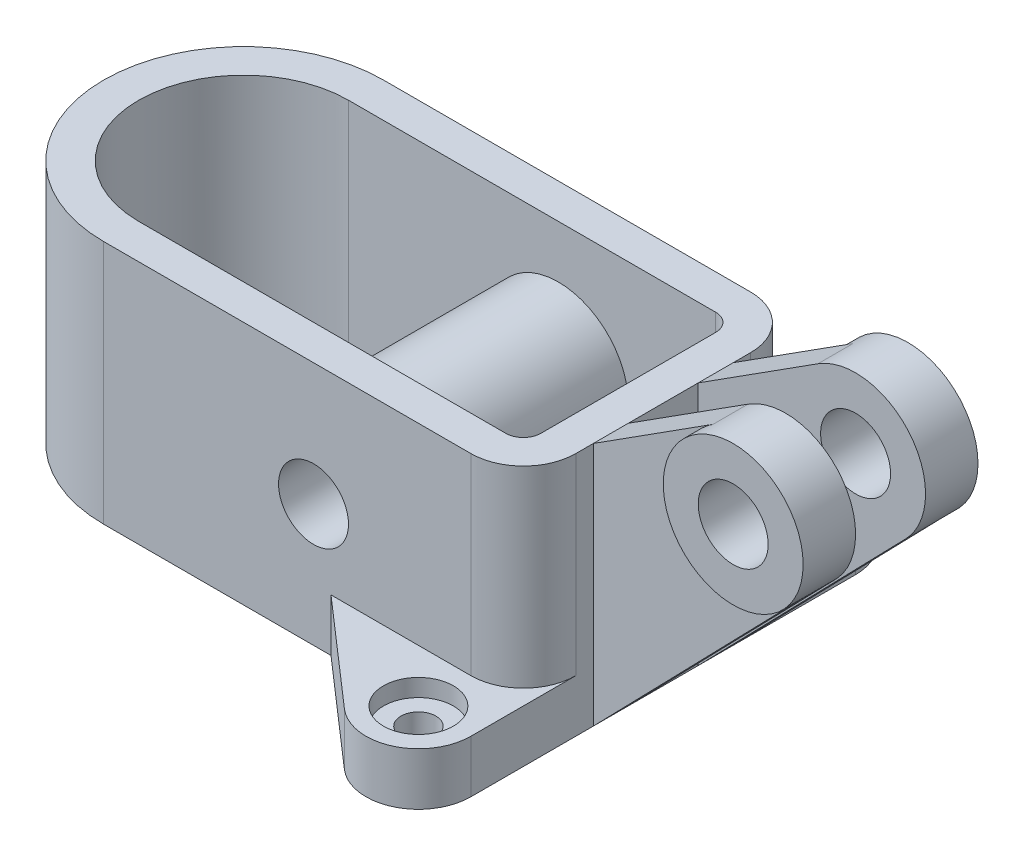
from build123d import *

# Parameters (mm, degrees)
BOSS_EXTRUDE1_DEPTH = 70
BOSS_EXTRUDE2_REACH = 162.312
SKETCH2_R           = 20
BOSS_EXTRUDE3_DEPTH = 15
HOLE1_D             = 10
HOLE1_CBORE_D       = 20
HOLE1_CBORE_DEPTH   = 5
HOLE2_D             = 10
HOLE2_CBORE_D       = 20
HOLE2_CBORE_DEPTH   = 20
BOSS_EXTRUDE4_START = 10
SKETCH10_R          = 20
SKETCH10_R_2        = 10
BOSS_EXTRUDE4_DEPTH = 15
BOSS_EXTRUDE5_START = -10
SKETCH11_R          = 20
SKETCH11_R_2        = 10
BOSS_EXTRUDE5_DEPTH = 15
BOSS_EXTRUDE6_DEPTH = 10
SKETCH13_R          = 5
BOSS_EXTRUDE7_DEPTH = 15


with BuildPart() as part:
    # Sketch1 → Boss-Extrude1 (new body)
    with BuildSketch(Plane(origin=(0, 0, 0), x_dir=(1, 0, 0), z_dir=(0, 1, 0))):
        with BuildLine():
            Line((0, 40), (105, 40))
            ThreePointArc((105, 40), (115.606601718, 35.606601718), (120, 25))
            Line((120, 25), (120, -25))
            ThreePointArc((120, -25), (115.606601718, -35.606601718), (105, -40))
            Line((105, -40), (0, -40))
            ThreePointArc((0, -40), (-40, 0), (0, 40))
        make_face()
        with BuildLine():
            Line((0, -30), (105, -30))
            ThreePointArc((105, -30), (108.535533906, -28.535533906), (110, -25))
            Line((110, -25), (110, 25))
            ThreePointArc((110, 25), (108.535533906, 28.535533906), (105, 30))
            Line((105, 30), (0, 30))
            ThreePointArc((0, 30), (-30, 0), (0, -30))
        make_face(mode=Mode.SUBTRACT)
    extrude(amount=BOSS_EXTRUDE1_DEPTH)

    # Sketch2 → Boss-Extrude2 (add, up to next)
    with BuildSketch(Plane.XY.offset(40), mode=Mode.PRIVATE) as boss_extrude2_sk1:
        with Locations((60, 35)):
            Circle(SKETCH2_R)
    boss_extrude2_tool1 = extrude(boss_extrude2_sk1.sketch, amount=-BOSS_EXTRUDE2_REACH, mode=Mode.PRIVATE) - part.part
    add(boss_extrude2_tool1.solids().sort_by_distance((60, 35, 40))[0])

    # Sketch3 → Boss-Extrude3 (add)
    with BuildSketch(Plane(origin=(0, 0, 0), x_dir=(1, 0, 0), z_dir=(0, 1, 0))):
        with BuildLine():
            Line((120, -25), (120, -55))
            ThreePointArc((120, -55), (111.207044165, -68.655497162), (95.136986301, -66.301369863))
            Line((95.136986301, -66.301369863), (65, -40))
            Line((65, -40), (105, -40))
            ThreePointArc((105, -40), (115.606601718, -35.606601718), (120, -25))
        make_face()
    boss_extrude3 = extrude(amount=BOSS_EXTRUDE3_DEPTH)

    # Mirror1: Boss-Extrude3 across plane
    add(boss_extrude3.mirror(Plane.XY))

    # Hole1 (through all)
    with Locations(Plane(origin=(0, 15, 0), x_dir=(1, 0, 0), z_dir=(0, 1, 0))):
        with Locations((105, -55), (105, 55)):
            CounterBoreHole(HOLE1_D / 2, HOLE1_CBORE_D / 2, HOLE1_CBORE_DEPTH)

    # Hole2 (through all)
    with Locations(Plane.XY.offset(40)):
        with Locations((60, 35)):
            CounterBoreHole(HOLE2_D / 2, HOLE2_CBORE_D / 2, HOLE2_CBORE_DEPTH)



with BuildPart() as body_2:
    # Sketch10 → Boss-Extrude4 (new body)
    with BuildSketch(Plane.XY.offset(BOSS_EXTRUDE4_START)):
        with Locations((165, 75)):
            Circle(SKETCH10_R)
        with Locations((165, 75)):
            Circle(SKETCH10_R_2, mode=Mode.SUBTRACT)
    extrude(amount=BOSS_EXTRUDE4_DEPTH)


with BuildPart() as body_3:
    # Sketch11 → Boss-Extrude5 (new body)
    with BuildSketch(Plane.XY.offset(BOSS_EXTRUDE5_START)):
        with Locations((165, 75)):
            Circle(SKETCH11_R)
        with Locations((165, 75)):
            Circle(SKETCH11_R_2, mode=Mode.SUBTRACT)
    extrude(amount=-BOSS_EXTRUDE5_DEPTH)


with BuildPart() as part_1:
    add(part.part)

    add(body_3.part)  # Boss-Extrude6 merges body 3
    # Sketch12 → Boss-Extrude6 (add)
    with BuildSketch(Plane.XY.offset(-10)):
        with BuildLine():
            Line((120, 15), (120, 0))
            Line((120, 0), (179.342535653, 61.061145275))
            ThreePointArc((179.342535653, 61.061145275), (149.498024882, 62.363197895), (154.238039414, 91.857645278))
            Line((154.238039414, 91.857645278), (120, 70))
            Line((120, 70), (120, 15))
        make_face()
    boss_extrude6 = extrude(amount=-BOSS_EXTRUDE6_DEPTH)

    # Mirror7: Boss-Extrude6 across plane
    add(boss_extrude6.mirror(Plane.XY))

    # Sketch13 → Boss-Extrude7 (add)
    with BuildSketch(Plane(origin=(0, 0, 0), x_dir=(1, 0, 0), z_dir=(0, 1, 0))):
        with BuildLine():
            Line((-28.284271247, 10), (0, 10))
            ThreePointArc((0, 10), (10, 0), (0, -10))
            Line((0, -10), (-28.284271247, -10))
            ThreePointArc((-28.284271247, -10), (-30, 0), (-28.284271247, 10))
        make_face()
        with Locations(Location((0, 0, 0), (0, 0, 270))):
            Circle(SKETCH13_R, mode=Mode.SUBTRACT)
    extrude(amount=BOSS_EXTRUDE7_DEPTH)


solid = Compound([body_2.part, part_1.part])
